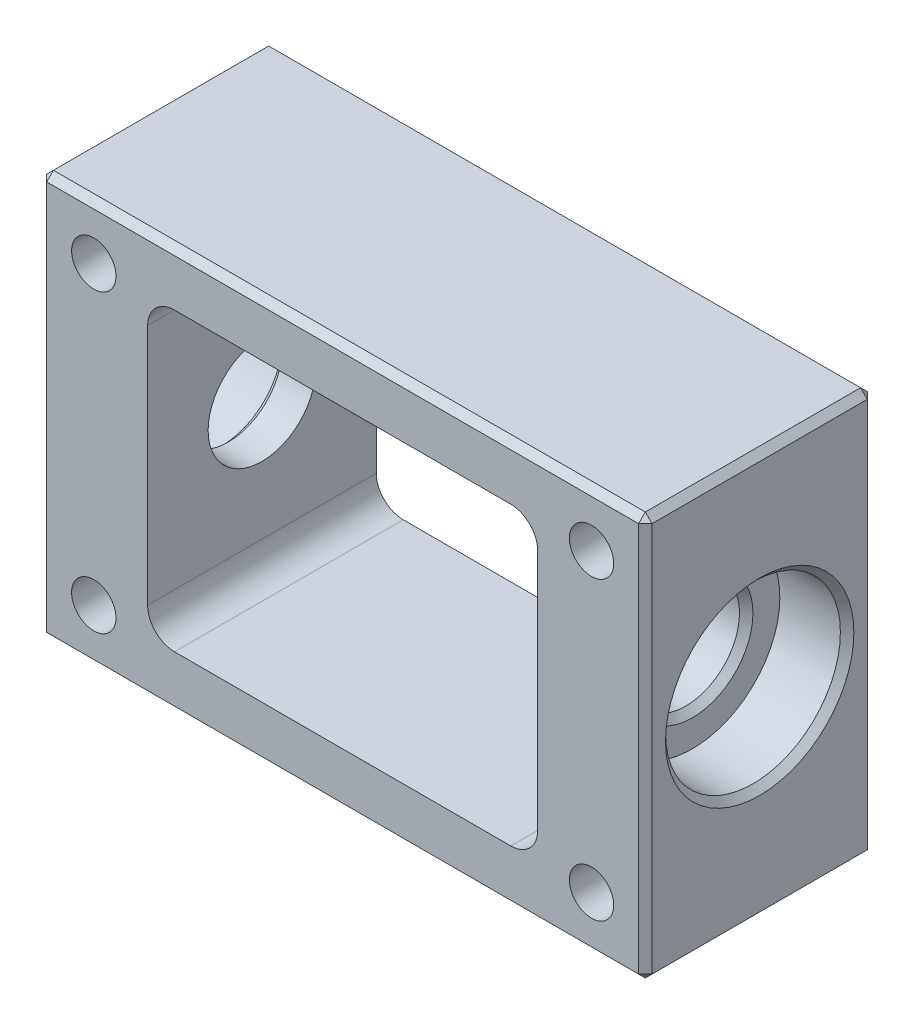
from build123d import *

# Parameters (mm, degrees)
SKETCH_1_W          = 45
SKETCH_1_H          = 30
EXTRUDE_1_DEPTH     = 8.5
SKETCH_2_R          = 6.5
CUT_EXTRUDE_1_DEPTH = 5
SKETCH_3_R          = 4
CUT_EXTRUDE_2_DEPTH = 53
CHAMFER_1_SIZE      = 0.5
HOLE_WIZARD_M4_1_D  = 3.3
SKETCH_7_W          = 29
SKETCH_7_H          = 22
CUT_EXTRUDE_3_DEPTH = 53
FILLET_1_R          = 2
CHAMFER_2_SIZE      = 0.5


with BuildPart() as part:
    # 草图1 → 凸台-拉伸1 (new, symmetric)
    with BuildSketch(Plane.XY):
        Rectangle(SKETCH_1_W, SKETCH_1_H)
    extrude(amount=EXTRUDE_1_DEPTH, both=True)

    # 草图2 → 切除-拉伸1 (cut)
    with BuildSketch(Plane(origin=(22.5, 0, 0), x_dir=(0, 0, -1), z_dir=(1, 0, 0))):
        Circle(SKETCH_2_R)
    cut_extrude_1 = extrude(amount=-CUT_EXTRUDE_1_DEPTH, mode=Mode.SUBTRACT)

    # 镜向1: 切除-拉伸1 across plane
    add(cut_extrude_1.mirror(Plane(origin=(0, 0, 0), x_dir=(0, 0, 1), z_dir=(1, 0, 0))), mode=Mode.SUBTRACT)

    # 草图3 → 切除-拉伸2 (cut)
    with BuildSketch(Plane(origin=(17.5, 0, 0), x_dir=(0, 0, -1), z_dir=(1, 0, 0))):
        Circle(SKETCH_3_R)
    extrude(amount=-CUT_EXTRUDE_2_DEPTH, mode=Mode.SUBTRACT)

    # 倒角1
    chamfer_1_edges = [part.edges().sort_by_distance(p)[0] for p in [
        (22.5, 0, 6.5),
        (-22.5, 0, 6.5),
        (-17.5, 0, 4),
        (17.5, 0, 4),
    ]]
    chamfer(chamfer_1_edges, length=CHAMFER_1_SIZE)

    # M4 螺纹孔1 (through all)
    with Locations(Plane(origin=(0, 0, -8.5), x_dir=(-1, 0, 0), z_dir=(0, 0, -1))):
        with Locations((-18.5, 11), (18.5, 11), (-18.5, -11), (18.5, -11)):
            Hole(HOLE_WIZARD_M4_1_D / 2)

    # 草图7 → 切除-拉伸3 (cut)
    with BuildSketch(Plane(origin=(0, 0, -8.5), x_dir=(-1, 0, 0), z_dir=(0, 0, -1))):
        Rectangle(SKETCH_7_W, SKETCH_7_H)
    extrude(amount=-CUT_EXTRUDE_3_DEPTH, mode=Mode.SUBTRACT)

    # 圆角1
    fillet_1_edges = [part.edges().sort_by_distance(p)[0] for p in [
        (-14.5, -11, 0),
        (14.5, 11, 0),
        (-14.5, 11, 0),
        (14.5, -11, 0),
    ]]
    fillet(fillet_1_edges, radius=FILLET_1_R)

    # 倒角2
    chamfer_2_edges = [part.edges().sort_by_distance(p)[0] for p in [
        (-22.5, 0, 8.5),
        (0, -15, 8.5),
        (22.5, 0, 8.5),
        (0, -15, -8.5),
        (-22.5, 0, -8.5),
        (0, 15, -8.5),
        (22.5, 0, -8.5),
        (22.5, -15, 0),
        (-22.5, -15, 0),
        (-22.5, 15, 0),
        (22.5, 15, 0),
        (0, 15, 8.5),
    ]]
    chamfer(chamfer_2_edges, length=CHAMFER_2_SIZE)


solid = part.part
